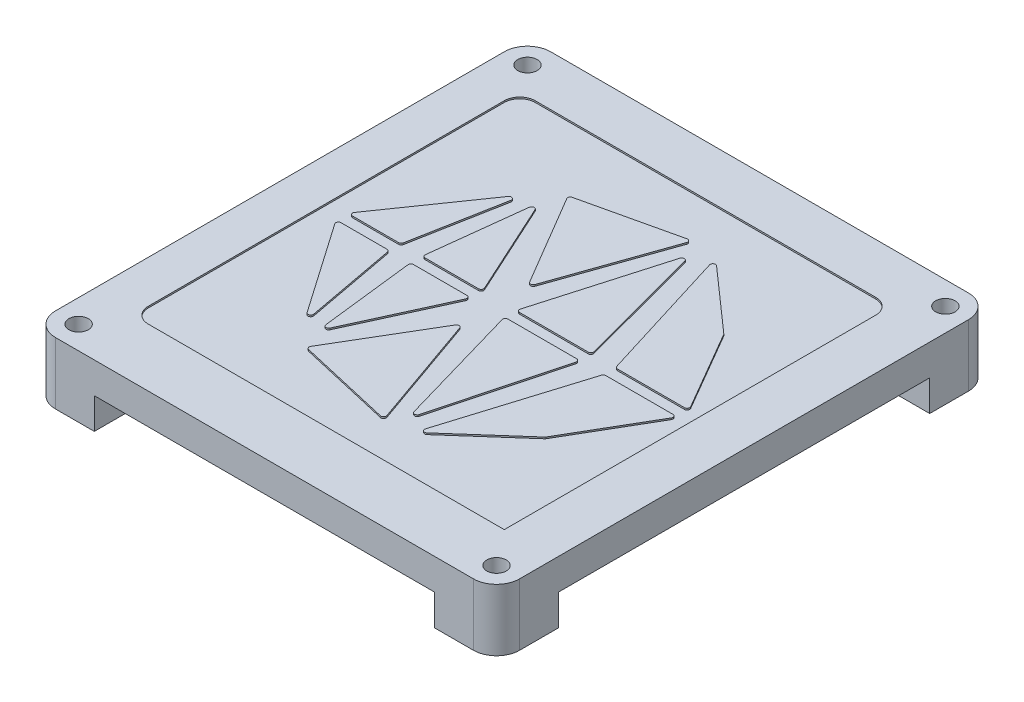
from build123d import *

# Parameters (mm, degrees)
EXTRUDE_1_DEPTH     = 4
EXTRUDE_START       = 4
EXTRUDE_2_DEPTH     = 4
SKETCH_3_R          = 1.25
CUT_EXTRUDE_1_DEPTH = 15
CUT_EXTRUDE_2_DEPTH = 0.2


with BuildPart() as part:
    # 草图1 → 凸台-拉伸1 (new body)
    with BuildSketch(Plane(origin=(0, 0, 0), x_dir=(1, 0, 0), z_dir=(0, 1, 0))):
        with BuildLine():
            Line((-27.00005461, -31.987363475), (27.00005461, -31.987363475))
            ThreePointArc((27.00005461, -31.987363475), (29.112398272, -31.112402082), (29.987359665, -29.00005842))
            Line((29.987359665, -29.00005842), (29.987359665, 29.00005842))
            ThreePointArc((29.987359665, 29.00005842), (29.112398272, 31.112402082), (27.00005461, 31.987363475))
            Line((27.00005461, 31.987363475), (-27.00005461, 31.987363475))
            ThreePointArc((-27.00005461, 31.987363475), (-29.112398272, 31.112402082), (-29.987359665, 29.00005842))
            Line((-29.987359665, 29.00005842), (-29.987359665, -29.00005842))
            ThreePointArc((-29.987359665, -29.00005842), (-29.112398272, -31.112402082), (-27.00005461, -31.987363475))
        make_face()
    extrude(amount=EXTRUDE_1_DEPTH)

    # 草图2 → 凸台-拉伸2 (add)
    with BuildSketch(Plane.XZ.offset(EXTRUDE_START)):
        with BuildLine():
            Line((-21.987359665, 23.987363475), (-21.987359665, 31.987363475))
            Line((-21.987359665, 31.987363475), (-27.00005461, 31.987363475))
            ThreePointArc((-27.00005461, 31.987363475), (-29.112398272, 31.112402082), (-29.987359665, 29.00005842))
            Line((-29.987359665, 29.00005842), (-29.987359665, 23.987363475))
            Line((-29.987359665, 23.987363475), (-21.987359665, 23.987363475))
        make_face()
        with BuildLine():
            Line((21.987359665, -23.987363475), (21.987359665, -31.987363475))
            Line((21.987359665, -31.987363475), (27.00005461, -31.987363475))
            ThreePointArc((27.00005461, -31.987363475), (29.112398272, -31.112402082), (29.987359665, -29.00005842))
            Line((29.987359665, -29.00005842), (29.987359665, -23.987363475))
            Line((29.987359665, -23.987363475), (21.987359665, -23.987363475))
        make_face()
        with BuildLine():
            Line((21.987359665, 23.987363475), (29.987359665, 23.987363475))
            Line((29.987359665, 23.987363475), (29.987359665, 29.00005842))
            ThreePointArc((29.987359665, 29.00005842), (29.112398272, 31.112402082), (27.00005461, 31.987363475))
            Line((27.00005461, 31.987363475), (21.987359665, 31.987363475))
            Line((21.987359665, 31.987363475), (21.987359665, 23.987363475))
        make_face()
        with BuildLine():
            Line((-29.987359665, -23.987363475), (-29.987359665, -29.00005842))
            ThreePointArc((-29.987359665, -29.00005842), (-29.112398272, -31.112402082), (-27.00005461, -31.987363475))
            Line((-27.00005461, -31.987363475), (-21.987359665, -31.987363475))
            Line((-21.987359665, -31.987363475), (-21.987359665, -23.987363475))
            Line((-21.987359665, -23.987363475), (-29.987359665, -23.987363475))
        make_face()
    extrude(amount=-EXTRUDE_2_DEPTH)

    # 草图3 → 切除-拉伸1 (cut)
    with BuildSketch(Plane.XZ.offset(4)):
        with Locations(Location((-27.00005461, 29.00005842, 0), (0, 0, 270))):
            Circle(SKETCH_3_R)
        with Locations(Location((27.00005461, 29.00005842, 0), (0, 0, 270))):
            Circle(SKETCH_3_R)
        with Locations(Location((27.00005461, -29.00005842, 0), (0, 0, 270))):
            Circle(SKETCH_3_R)
        with Locations(Location((-27.00005461, -29.00005842, 0), (0, 0, 270))):
            Circle(SKETCH_3_R)
    extrude(amount=-CUT_EXTRUDE_1_DEPTH, mode=Mode.SUBTRACT)

    # 草图5 → 切除-拉伸2 (cut)
    with BuildSketch(Plane(origin=(0, 4, 0), x_dir=(1, 0, 0), z_dir=(0, 1, 0))):
        with BuildLine():
            ThreePointArc((-24.510212589, -22.489370571), (-23.924426151, -23.903584133), (-22.510212589, -24.489370571))
            Line((-22.510212589, -24.489370571), (23.489787411, -24.489370571))
            Line((23.489787411, -24.489370571), (23.489787411, 23.510629429))
            ThreePointArc((23.489787411, 23.510629429), (22.904000974, 24.924842991), (21.489787411, 25.510629429))
            Line((21.489787411, 25.510629429), (-22.510212589, 25.510629429))
            ThreePointArc((-22.510212589, 25.510629429), (-23.924426151, 24.924842991), (-24.510212589, 23.510629429))
            Line((-24.510212589, 23.510629429), (-24.510212589, -22.489370571))
        make_face()
        with BuildLine():
            Line((-21.404655137, -0.688500192), (-15.457204068, -0.688500192))
            ThreePointArc((-15.457204068, -0.688500192), (-15.242140256, -0.766165613), (-15.126321966, -0.963321604))
            Line((-15.126321966, -0.963321604), (-12.93890785, -12.678969469))
            ThreePointArc((-12.93890785, -12.678969469), (-13.010855373, -12.95581187), (-13.269789952, -13.077348057))
            ThreePointArc((-13.269789952, -13.077348057), (-13.425801703, -13.039009509), (-13.546274154, -12.932727342))
            Line((-13.546274154, -12.932727342), (-21.681139339, -1.217079478))
            ThreePointArc((-21.681139339, -1.217079478), (-21.702916589, -0.869088442), (-21.404655137, -0.688500192))
        make_face(mode=Mode.SUBTRACT)
        with BuildLine():
            Line((-9.512596077, -16.472848359), (-2.571281975, -4.734690874))
            ThreePointArc((-2.571281975, -4.734690874), (-2.248646777, -4.571034999), (-1.964018884, -4.794336767))
            Line((-1.964018884, -4.794336767), (3.140150939, -19.305798562))
            ThreePointArc((3.140150939, -19.305798562), (3.097295639, -19.61204324), (2.822620241, -19.754084802))
            ThreePointArc((2.822620241, -19.754084802), (2.784616416, -19.75193251), (2.7470986, -19.745503158))
            Line((2.7470986, -19.745503158), (-9.298385325, -16.972198847))
            ThreePointArc((-9.298385325, -16.972198847), (-9.53220226, -16.77688017), (-9.512596077, -16.472848359))
        make_face(mode=Mode.SUBTRACT)
        with BuildLine():
            Line((-12.041068111, -0.688500192), (-5.131124443, -0.688500192))
            ThreePointArc((-5.131124443, -0.688500192), (-4.847891187, -0.843225283), (-4.825045876, -1.165155435))
            Line((-4.825045876, -1.165155435), (-10.329425017, -13.194497943))
            ThreePointArc((-10.329425017, -13.194497943), (-10.453628675, -13.337675957), (-10.635503584, -13.391042701))
            ThreePointArc((-10.635503584, -13.391042701), (-10.859278656, -13.305887083), (-10.969829102, -13.093506855))
            Line((-10.969829102, -13.093506855), (-12.375393629, -1.064164346))
            ThreePointArc((-12.375393629, -1.064164346), (-12.292512493, -0.80132512), (-12.041068111, -0.688500192))
        make_face(mode=Mode.SUBTRACT)
        with BuildLine():
            Line((9.36207412, -1.111559506), (5.109122277, -17.113456876))
            ThreePointArc((5.109122277, -17.113456876), (4.988995356, -17.293832498), (4.783815734, -17.363597563))
            ThreePointArc((4.783815734, -17.363597563), (4.581434131, -17.295960844), (4.460386024, -17.120232659))
            Line((4.460386024, -17.120232659), (-0.152481619, -1.118335289))
            ThreePointArc((-0.152481619, -1.118335289), (-0.098015191, -0.822718589), (0.17094809, -0.688500192))
            Line((0.17094809, -0.688500192), (9.036767577, -0.688500192))
            ThreePointArc((9.036767577, -0.688500192), (9.303602512, -0.81992057), (9.36207412, -1.111559506))
        make_face(mode=Mode.SUBTRACT)
        with BuildLine():
            Line((12.808517611, -0.688500192), (21.484169915, -0.688500192))
            ThreePointArc((21.484169915, -0.688500192), (21.775984057, -0.857338258), (21.775051109, -1.194474604))
            Line((21.775051109, -1.194474604), (15.823663685, -11.415302329))
            ThreePointArc((15.823663685, -11.415302329), (15.793013116, -11.45942167), (15.755733936, -11.498102884))
            Line((15.755733936, -11.498102884), (7.668279808, -18.648335147))
            ThreePointArc((7.668279808, -18.648335147), (7.564528755, -18.710947136), (7.445328364, -18.732760181))
            ThreePointArc((7.445328364, -18.732760181), (7.174474873, -18.596004987), (7.123708261, -18.296862298))
            Line((7.123708261, -18.296862298), (12.486897508, -0.92580231))
            ThreePointArc((12.486897508, -0.92580231), (12.608672805, -0.754246701), (12.808517611, -0.688500192))
        make_face(mode=Mode.SUBTRACT)
        with BuildLine():
            Line((-21.681139339, 1.332693738), (-13.546274154, 13.048341603))
            ThreePointArc((-13.546274154, 13.048341603), (-13.14002845, 13.166944855), (-12.93890785, 12.794583729))
            Line((-12.93890785, 12.794583729), (-15.126321966, 1.078935865))
            ThreePointArc((-15.126321966, 1.078935865), (-15.242140256, 0.881779873), (-15.457204068, 0.804114453))
            Line((-15.457204068, 0.804114453), (-21.404655137, 0.804114453))
            ThreePointArc((-21.404655137, 0.804114453), (-21.702916589, 0.984702702), (-21.681139339, 1.332693738))
        make_face(mode=Mode.SUBTRACT)
        with BuildLine():
            Line((-12.375393629, 1.179778607), (-10.969829102, 13.209121115))
            ThreePointArc((-10.969829102, 13.209121115), (-10.68793709, 13.502547995), (-10.329425017, 13.310112203))
            Line((-10.329425017, 13.310112203), (-4.825045876, 1.280769695))
            ThreePointArc((-4.825045876, 1.280769695), (-4.847891187, 0.958839543), (-5.131124443, 0.804114453))
            Line((-5.131124443, 0.804114453), (-12.041068111, 0.804114453))
            ThreePointArc((-12.041068111, 0.804114453), (-12.292512493, 0.916939381), (-12.375393629, 1.179778607))
        make_face(mode=Mode.SUBTRACT)
        with BuildLine():
            Line((-2.571281975, 4.850305134), (-9.512596077, 16.588462619))
            ThreePointArc((-9.512596077, 16.588462619), (-9.53220226, 16.89249443), (-9.298385325, 17.087813107))
            Line((-9.298385325, 17.087813107), (2.7470986, 19.861117418))
            ThreePointArc((2.7470986, 19.861117418), (3.073572684, 19.75742568), (3.140150939, 19.421412823))
            Line((3.140150939, 19.421412823), (-1.964018884, 4.909951027))
            ThreePointArc((-1.964018884, 4.909951027), (-2.086991143, 4.746961869), (-2.281549581, 4.685037267))
            ThreePointArc((-2.281549581, 4.685037267), (-2.448326624, 4.729259125), (-2.571281975, 4.850305134))
        make_face(mode=Mode.SUBTRACT)
        with BuildLine():
            Line((9.036767577, 0.804114453), (0.17094809, 0.804114453))
            ThreePointArc((0.17094809, 0.804114453), (-0.098015191, 0.93833285), (-0.152481619, 1.233949549))
            Line((-0.152481619, 1.233949549), (4.460386024, 17.235846919))
            ThreePointArc((4.460386024, 17.235846919), (4.78733119, 17.479193465), (5.109122277, 17.229071137))
            Line((5.109122277, 17.229071137), (9.36207412, 1.227173766))
            ThreePointArc((9.36207412, 1.227173766), (9.303602512, 0.93553483), (9.036767577, 0.804114453))
        make_face(mode=Mode.SUBTRACT)
        with BuildLine():
            Line((21.484169915, 0.804114453), (12.808517611, 0.804114453))
            ThreePointArc((12.808517611, 0.804114453), (12.608672805, 0.869860962), (12.486897508, 1.04141657))
            Line((12.486897508, 1.04141657), (7.123708261, 18.412476559))
            ThreePointArc((7.123708261, 18.412476559), (7.262798457, 18.794586027), (7.668279808, 18.763949407))
            Line((7.668279808, 18.763949407), (15.755733936, 11.613717144))
            ThreePointArc((15.755733936, 11.613717144), (15.793013116, 11.57503593), (15.823663685, 11.53091659))
            Line((15.823663685, 11.53091659), (21.775051109, 1.310088864))
            ThreePointArc((21.775051109, 1.310088864), (21.775984057, 0.972952518), (21.484169915, 0.804114453))
        make_face(mode=Mode.SUBTRACT)
    extrude(amount=-CUT_EXTRUDE_2_DEPTH, mode=Mode.SUBTRACT)


solid = part.part
